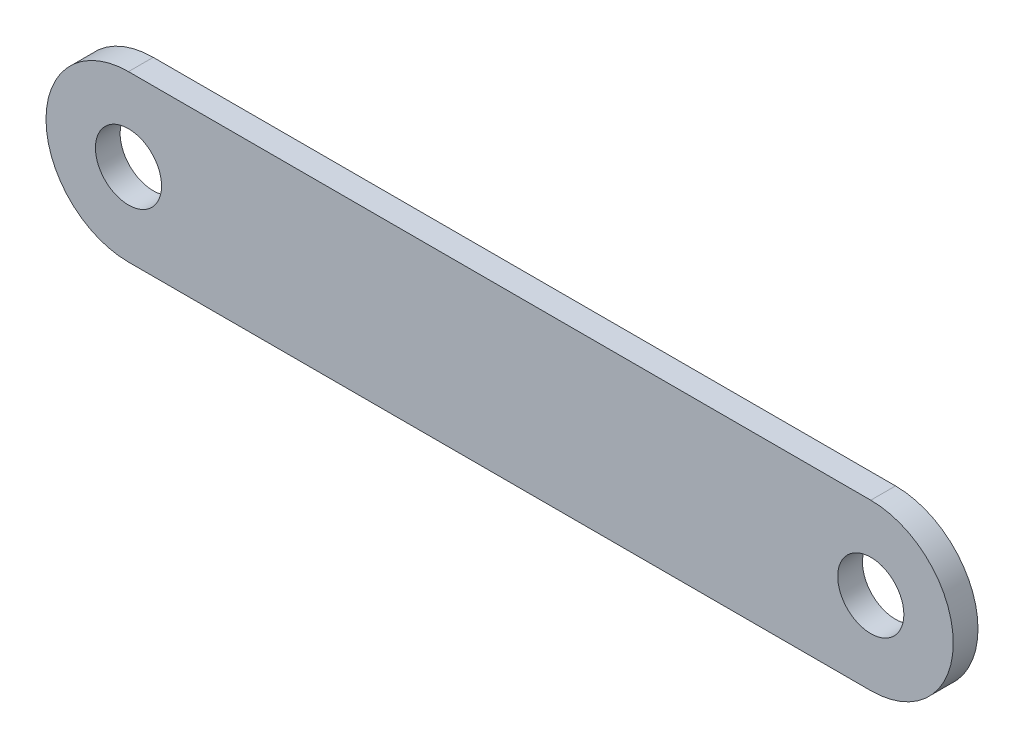
from build123d import *

# Parameters (mm, degrees)
BOSS_EXTRUDE1_DEPTH = 3
SKETCH2_R           = 4.01
CUT_EXTRUDE1_DEPTH  = 10


with BuildPart() as part:
    # Sketch1 → Boss-Extrude1 (new body)
    with BuildSketch(Plane.XY):
        with BuildLine():
            Line((90, 10), (0, 10))
            ThreePointArc((0, 10), (-10, 0), (0, -10))
            Line((0, -10), (90, -10))
            ThreePointArc((90, -10), (100, 0), (90, 10))
        make_face()
    extrude(amount=BOSS_EXTRUDE1_DEPTH)

    # Sketch2 → Cut-Extrude1 (cut)
    with BuildSketch(Plane.XY.offset(3)):
        Circle(SKETCH2_R)
        with Locations((90, 0)):
            Circle(SKETCH2_R)
    extrude(amount=-CUT_EXTRUDE1_DEPTH, mode=Mode.SUBTRACT)


solid = part.part
